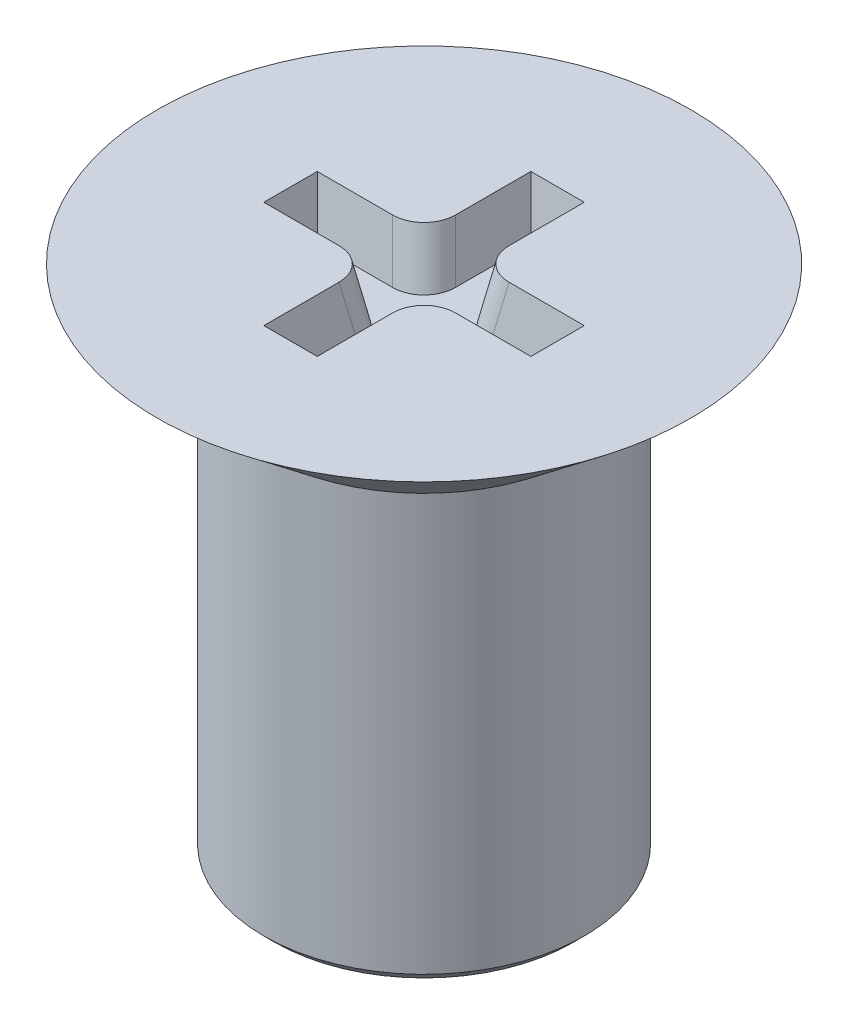
from build123d import *

# Parameters (mm, degrees)
SKETCH_2_R                    = 1.5
EXTRUDE_1_DEPTH               = 4
CHAMFER_1_SIZE                = 0.1
SKETCH_3_W                    = 2.5
SKETCH_3_H                    = 0.5
CUT_EXTRUDE_1_DEPTH           = 0.5
CUT_EXTRUDE_1_DRAFT           = -10
SKETCH_3_W_2                  = 0.5
SKETCH_3_H_2                  = 2.5
CUT_EXTRUDE_1_PROFILE_2_DEPTH = 0.5
CUT_EXTRUDE_1_PROFILE_2_DRAFT = -10
FILLET_1_R                    = 0.3


with BuildPart() as part:
    # 草图1 → 旋转1 (revolve)
    with BuildSketch(Plane.XY, mode=Mode.PRIVATE) as revolve_1_sk:
        Polygon((0, 0), (2.5, 0), (1.5, -0.8), (0, -0.8), align=None)
    revolve(revolve_1_sk.sketch.rotate(Axis((0, -0.8, 0), (0, 1, 0)), 90), axis=Axis((0, -0.8, 0), (0, 1, 0)))

    # 草图2 → 凸台-拉伸1 (add)
    with BuildSketch(Plane.XZ.offset(0.8)):
        with Locations(Location((0, 0, 0), (0, 0, 270))):
            Circle(SKETCH_2_R)
    extrude(amount=EXTRUDE_1_DEPTH)

    # 倒角1
    chamfer_1_edges = [part.edges().sort_by_distance(p)[0] for p in [
        (0, -4.8, 1.5),
    ]]
    chamfer(chamfer_1_edges, length=CHAMFER_1_SIZE)


with BuildPart() as cut_extrude_1_tool:
    # 草图3 → 切除-拉伸1 (with draft: the straight prism first)
    with BuildSketch(Plane(origin=(0, 0, 0), x_dir=(1, 0, 0), z_dir=(0, 1, 0))):
        Rectangle(SKETCH_3_W, SKETCH_3_H)
    extrude(amount=-CUT_EXTRUDE_1_DEPTH)
    # 切除-拉伸1: the draft: its side faces are tilted about the plane it starts from
    cut_extrude_1_sides = [cut_extrude_1_tool.faces().sort_by_distance(p)[0] for p in [
        (0, -0.25, 0.25),
        (1.25, -0.25, 0),
        (0, -0.25, -0.25),
        (-1.25, -0.25, 0),
    ]]
    draft(cut_extrude_1_sides, Plane(origin=(0, 0, 0), x_dir=(1, 0, 0), z_dir=(0, 1, 0)), CUT_EXTRUDE_1_DRAFT)


with BuildPart() as part_1:
    add(part.part)

    # 切除-拉伸1: cut by cut_extrude_1_tool
    add(cut_extrude_1_tool.part, mode=Mode.SUBTRACT)


with BuildPart() as cut_extrude_1_profile_2_tool:
    # 草图3 → 切除-拉伸1 profile 2 (with draft: the straight prism first)
    with BuildSketch(Plane(origin=(0, 0, 0), x_dir=(1, 0, 0), z_dir=(0, 1, 0))):
        Rectangle(SKETCH_3_W_2, SKETCH_3_H_2)
    extrude(amount=-CUT_EXTRUDE_1_PROFILE_2_DEPTH)
    # 切除-拉伸1 profile 2: the draft: its side faces are tilted about the plane it starts from
    cut_extrude_1_profile_2_sides = [cut_extrude_1_profile_2_tool.faces().sort_by_distance(p)[0] for p in [
        (-0.25, -0.25, 0),
        (0, -0.25, 1.25),
        (0.25, -0.25, 0),
        (0, -0.25, -1.25),
    ]]
    draft(cut_extrude_1_profile_2_sides, Plane(origin=(0, 0, 0), x_dir=(1, 0, 0), z_dir=(0, 1, 0)), CUT_EXTRUDE_1_PROFILE_2_DRAFT)


with BuildPart() as part_2:
    add(part_1.part)

    # 切除-拉伸1 profile 2: cut by cut_extrude_1_profile_2_tool
    add(cut_extrude_1_profile_2_tool.part, mode=Mode.SUBTRACT)

    # 圆角1
    fillet_1_edges = [part_2.edges().sort_by_distance(p)[0] for p in [
        (0.205918255, -0.25, -0.205918255),
        (0.205918255, -0.25, 0.205918255),
        (-0.205918255, -0.25, 0.205918255),
        (-0.205918255, -0.25, -0.205918255),
    ]]
    fillet(fillet_1_edges, radius=FILLET_1_R)


solid = part_2.part
